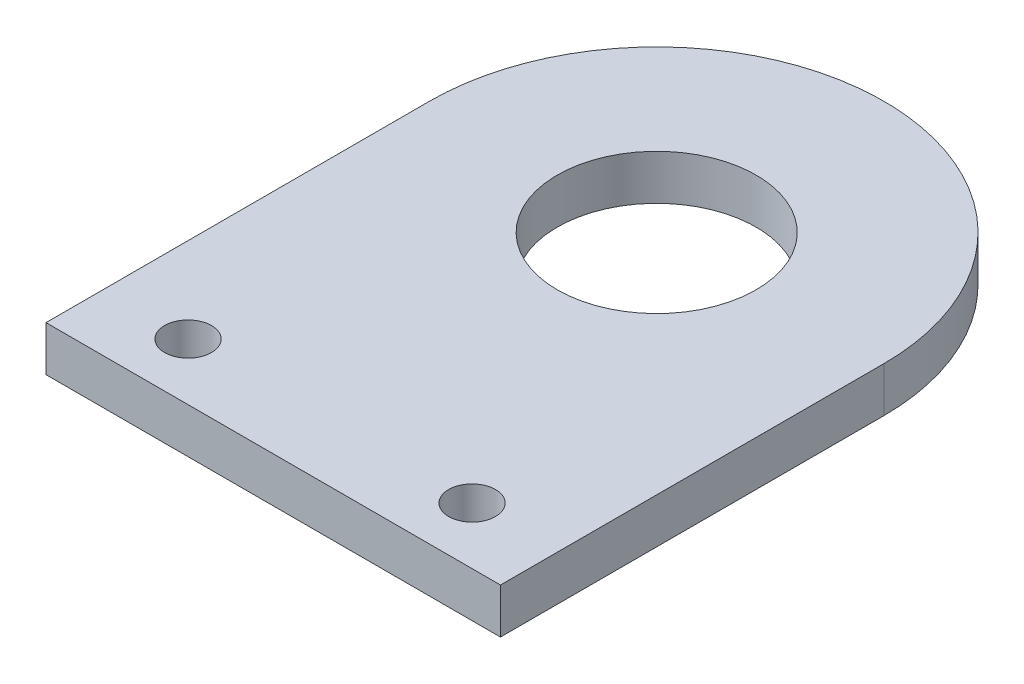
from build123d import *

# Parameters (mm, degrees)
SKETCH1_R           = 1.65
SKETCH1_R_2         = 7
BOSS_EXTRUDE1_DEPTH = 3.175


with BuildPart() as part:
    # Sketch1 → Boss-Extrude1 (new body)
    with BuildSketch(Plane(origin=(0, 0, 0), x_dir=(1, 0, 0), z_dir=(0, 1, 0))):
        with BuildLine():
            Line((0, 0), (32, 0))
            Line((32, 0), (32, 27))
            ThreePointArc((32, 27), (16, 43), (0, 27))
            Line((0, 27), (0, 0))
        make_face()
        with Locations(Location((6, 4, 0), (0, 0, 270))):
            Circle(SKETCH1_R, mode=Mode.SUBTRACT)
        with Locations(Location((26, 4, 0), (0, 0, 270))):
            Circle(SKETCH1_R, mode=Mode.SUBTRACT)
        with Locations(Location((16, 27, 0), (0, 0, 270))):
            Circle(SKETCH1_R_2, mode=Mode.SUBTRACT)
    extrude(amount=BOSS_EXTRUDE1_DEPTH)


solid = part.part
